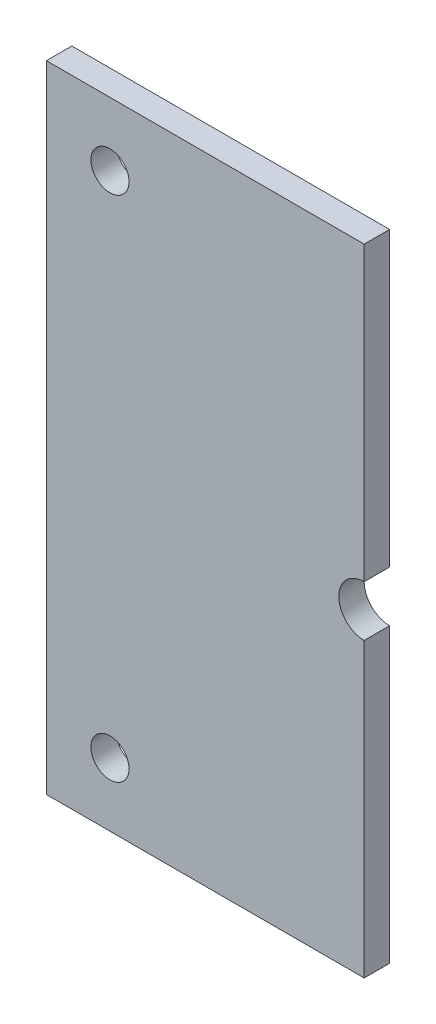
from build123d import *

# Parameters (mm, degrees)
SKETCH_1_W          = 50
SKETCH_1_H          = 50
SKETCH_1_R          = 2
SKETCH_1_R_2        = 1.5
EXTRUDE_1_DEPTH     = 2
SKETCH_3_W          = 33.603167957
SKETCH_3_H          = 55.181672871
CUT_EXTRUDE_2_DEPTH = 10


with BuildPart() as part:
    # 草图1 → 凸台-拉伸1 (new body)
    with BuildSketch(Plane.XY):
        Rectangle(SKETCH_1_W, SKETCH_1_H)
        Circle(SKETCH_1_R, mode=Mode.SUBTRACT)
        with Locations((-20, 20)):
            Circle(SKETCH_1_R_2, mode=Mode.SUBTRACT)
        with Locations(Location((20, 20, 0), (0, 0, 180))):
            Circle(SKETCH_1_R_2, mode=Mode.SUBTRACT)
        with Locations((20, -20)):
            Circle(SKETCH_1_R_2, mode=Mode.SUBTRACT)
        with Locations(Location((-20, -20, 0), (0, 0, 180))):
            Circle(SKETCH_1_R_2, mode=Mode.SUBTRACT)
    extrude(amount=EXTRUDE_1_DEPTH)

    # 草图3 → 切除-拉伸2 (cut)
    with BuildSketch(Plane.XY.offset(2)):
        with Locations((16.801583979, -0.050186901)):
            Rectangle(SKETCH_3_W, SKETCH_3_H)
    extrude(amount=-CUT_EXTRUDE_2_DEPTH, mode=Mode.SUBTRACT)


solid = part.part
